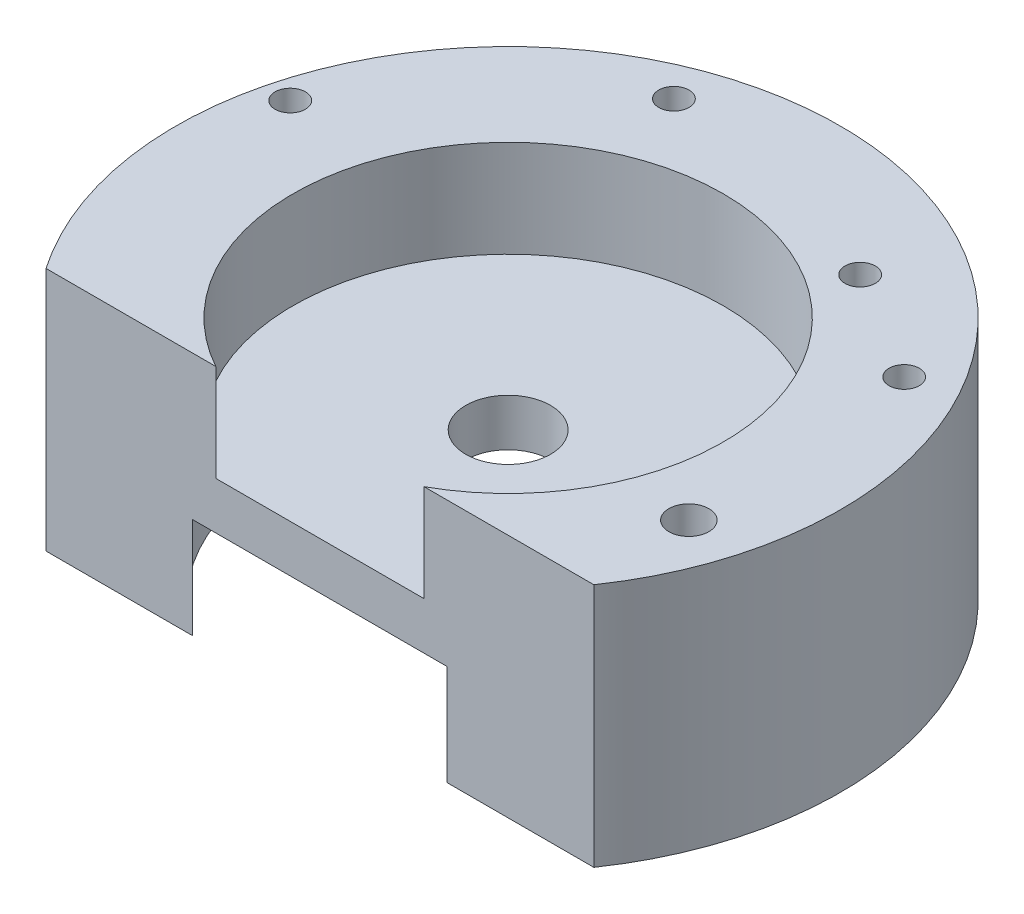
from build123d import *

# Parameters (mm, degrees)
SKETCH_2_W            = 45.206404826
SKETCH_2_H            = 11.893552363
CUT_EXTRUDE_1_DEPTH   = 44.729866796
M3_TAPPED_HOLE1_D     = 2.5
M3_TAPPED_HOLE1_DEPTH = 15
M3_TAPPED_HOLE1_TIP   = 0.751075774
CUT_EXTRUDE_START     = -20.2
SKETCH_6_R            = 1.25
CUT_EXTRUDE_3_DEPTH   = 10
M4X0_7_TAPPED_HOLE1_D = 3.3


with BuildPart() as part:
    # Эскиз1 → Повернуть1 (revolve)
    with BuildSketch(Plane.XY, mode=Mode.PRIVATE) as revolve_1_sk:
        Polygon((-27.425, 0), (-18.75, 0), (-18.75, 8.3), (-3.5, 8.3), (-3.5, 12.2), (-17.75, 12.2), (-17.75, 20.2), (-27.425, 20.2), align=None)
    revolve(revolve_1_sk.sketch.rotate(Axis((0, 0, 0), (0, 1, 0)), 270), axis=Axis((0, 0, 0), (0, 1, 0)))

    # Эскиз2 → Вырез-Вытянуть1 (cut, through all)
    with BuildSketch(Plane.XZ):
        with Locations((0, 21.478223819)):
            Rectangle(SKETCH_2_W, SKETCH_2_H)
    extrude(amount=-CUT_EXTRUDE_1_DEPTH, mode=Mode.SUBTRACT)

    # M3 Tapped Hole1
    with Locations(Plane(origin=(0, 20.2, 0), x_dir=(1, 0, 0), z_dir=(0, 1, 0))):
        with Locations((11.435398966, 17.613394065)):
            Hole(M3_TAPPED_HOLE1_D / 2, depth=M3_TAPPED_HOLE1_DEPTH)
            with Locations((0, 0, -(M3_TAPPED_HOLE1_DEPTH + M3_TAPPED_HOLE1_TIP / 2))):  # 118° drill point
                Cone(0, M3_TAPPED_HOLE1_D / 2, M3_TAPPED_HOLE1_TIP, mode=Mode.SUBTRACT)

    # Эскиз6 → Вырез-Вытянуть3 (cut)
    with BuildSketch(Plane.XZ.offset(CUT_EXTRUDE_START)):
        with Locations(Location((20.561874638, -12.118552363, 0), (0, 0, 270))):
            Circle(SKETCH_6_R)
        with Locations(Location((-8.822328368, -22.500922696, 0), (0, 0, 270))):
            Circle(SKETCH_6_R)
        with Locations(Location((-24.522435774, -6.541065947, 0), (0, 0, 270))):
            Circle(SKETCH_6_R)
    extrude(amount=CUT_EXTRUDE_3_DEPTH, mode=Mode.SUBTRACT)

    # M4x0.7 Tapped Hole1 (through all)
    with Locations(Plane(origin=(0, 0, 0), x_dir=(-1, 0, 0), z_dir=(0, -1, 0))):
        with Locations((-21.909616243, -6.997765079)):
            Hole(M4X0_7_TAPPED_HOLE1_D / 2)


solid = part.part
